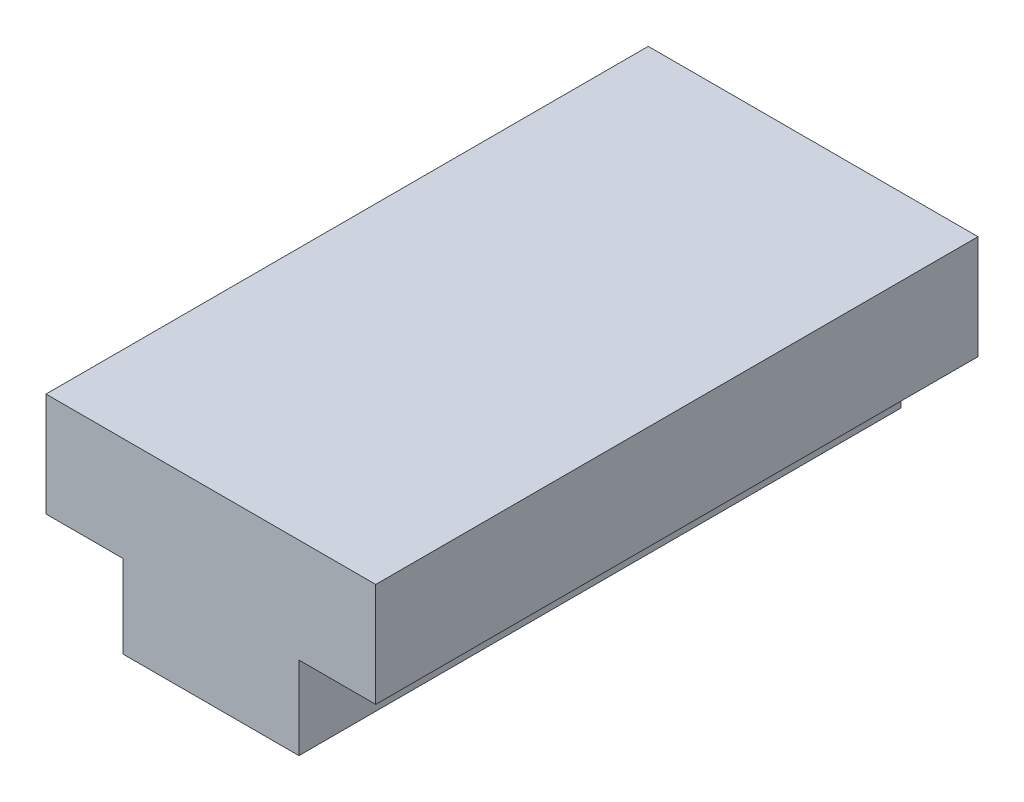
from build123d import *

# Parameters (mm, degrees)
BOSS_EXTRUDE1_DEPTH = 40


with BuildPart() as part:
    # Sketch1 → Boss-Extrude1 (new body)
    with BuildSketch(Plane.XY):
        Polygon((5.85, 0), (5.85, -5.5), (-5.85, -5.5), (-5.85, 0), (-10.95, 0), (-10.95, 6.9), (10.95, 6.9), (10.95, 0), align=None)
    extrude(amount=-BOSS_EXTRUDE1_DEPTH)


solid = part.part
